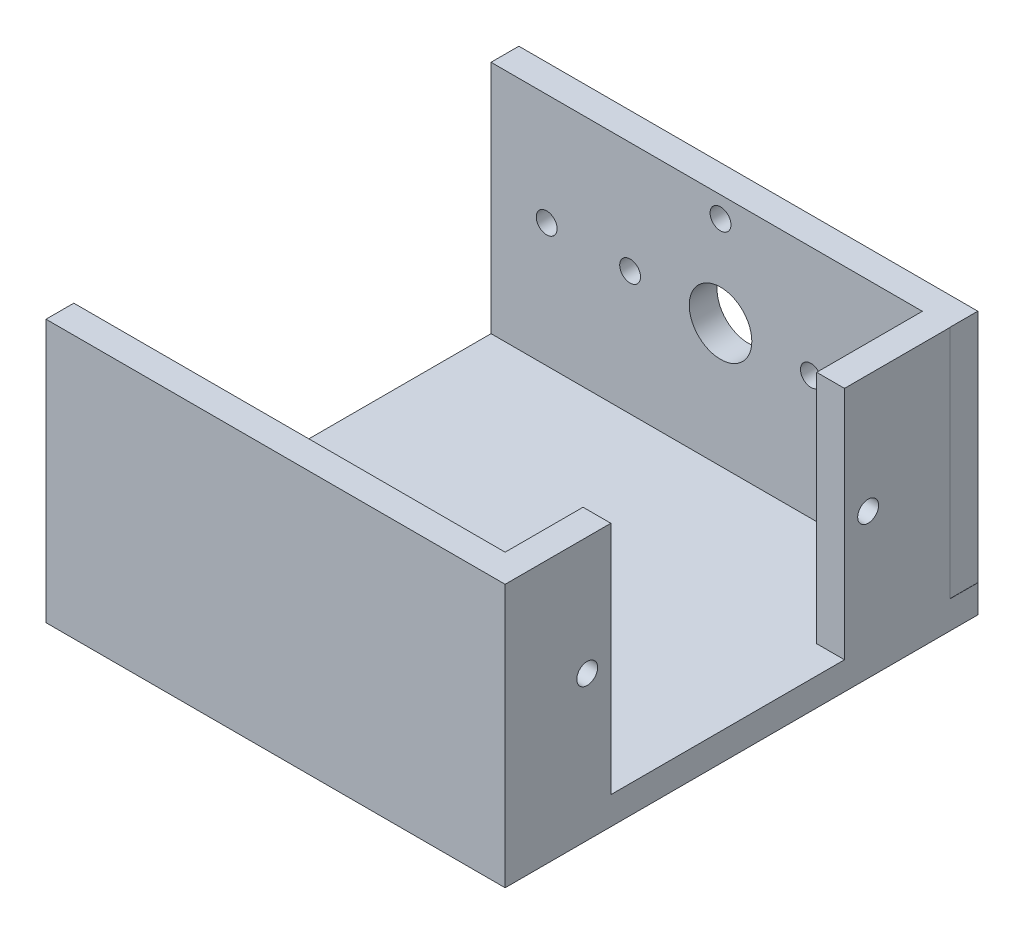
from build123d import *

# Parameters (mm, degrees)
SKETCH_1_W      = 33
SKETCH_1_H      = 18.9
SKETCH_1_R      = 2.25
SKETCH_1_R_2    = 0.75
EXTRUDE_1_DEPTH = 2
SKETCH_3_W      = 33.014157098
SKETCH_3_H      = 32
EXTRUDE_2_DEPTH = 2
SKETCH_7_W      = 5.6
SKETCH_7_H      = 16.9
SKETCH_7_R      = 0.75
SKETCH_7_W_2    = 7.6
EXTRUDE_3_DEPTH = 2
SKETCH_8_W      = 33.014157098
SKETCH_8_H      = 18.9
EXTRUDE_4_DEPTH = 2


with BuildPart() as part:
    # 草图1 → 凸台-拉伸1 (new body)
    with BuildSketch(Plane.XY):
        with Locations((0, 9.45)):
            Rectangle(SKETCH_1_W, SKETCH_1_H)
        with Locations((0, 10.9)):
            Circle(SKETCH_1_R, mode=Mode.SUBTRACT)
        with Locations((0, 17.4)):
            Circle(SKETCH_1_R_2, mode=Mode.SUBTRACT)
        with Locations((-6.5, 10.9)):
            Circle(SKETCH_1_R_2, mode=Mode.SUBTRACT)
        with Locations((-12.5, 10.9)):
            Circle(SKETCH_1_R_2, mode=Mode.SUBTRACT)
        with Locations(Location((6.5, 10.9, 0), (0, 0, 180))):
            Circle(SKETCH_1_R_2, mode=Mode.SUBTRACT)
        with Locations(Location((12.5, 10.9, 0), (0, 0, 180))):
            Circle(SKETCH_1_R_2, mode=Mode.SUBTRACT)
    extrude(amount=EXTRUDE_1_DEPTH)

    # 草图3 → 凸台-拉伸2 (add)
    with BuildSketch(Plane.XZ):
        with Locations((0.007078549, 16)):
            Rectangle(SKETCH_3_W, SKETCH_3_H)
    extrude(amount=-EXTRUDE_2_DEPTH)

    # 草图7 → 凸台-拉伸3 (add)
    # profile 1 of 2: a face of its own
    with BuildSketch(Plane(origin=(16.514157098, 0, 0), x_dir=(0, 0, -1), z_dir=(1, 0, 0))):
        with Locations((-29.2, 10.45)):
            Rectangle(SKETCH_7_W, SKETCH_7_H)
        with Locations(Location((-28.1, 10.4, 0), (0, 0, 180))):
            Circle(SKETCH_7_R, mode=Mode.SUBTRACT)
    # profile 2 of 2: a face of its own
    with BuildSketch(Plane(origin=(16.514157098, 0, 0), x_dir=(0, 0, -1), z_dir=(1, 0, 0))):
        with Locations((-5.8, 10.45)):
            Rectangle(SKETCH_7_W_2, SKETCH_7_H)
        with Locations((-7.9, 10.4)):
            Circle(SKETCH_7_R, mode=Mode.SUBTRACT)
    extrude(amount=-EXTRUDE_3_DEPTH)

    # 草图8 → 凸台-拉伸4 (add)
    with BuildSketch(Plane.XY.offset(32)):
        with Locations((0.007078549, 9.45)):
            Rectangle(SKETCH_8_W, SKETCH_8_H)
    extrude(amount=EXTRUDE_4_DEPTH)


solid = part.part
